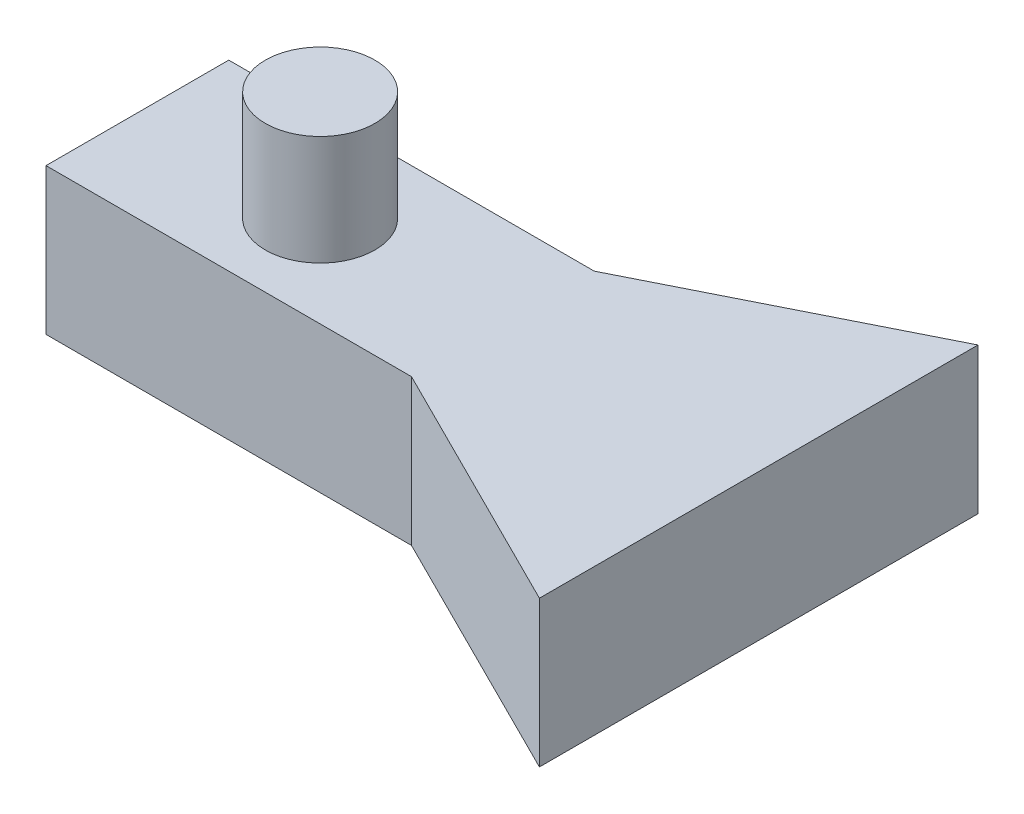
from build123d import *

# Parameters (mm, degrees)
SKETCH1_W           = 1000
SKETCH1_H           = 500
BOSS_EXTRUDE1_DEPTH = 400
SKETCH2_R           = 150
BOSS_EXTRUDE2_DEPTH = 300


with BuildPart() as part:
    # Sketch1 → Boss-Extrude1 (new body)
    with BuildSketch(Plane(origin=(0, 0, 0), x_dir=(1, 0, 0), z_dir=(0, 1, 0))):
        Polygon((1700, -350), (1000, 0), (1000, 500), (1700, 850), align=None)
        with Locations((500, 250)):
            Rectangle(SKETCH1_W, SKETCH1_H)
    extrude(amount=BOSS_EXTRUDE1_DEPTH)

    # Sketch2 → Boss-Extrude2 (add)
    with BuildSketch(Plane(origin=(0, 400, 0), x_dir=(1, 0, 0), z_dir=(0, 1, 0))):
        with Locations(Location((500, 250, 0), (0, 0, 270))):
            Circle(SKETCH2_R)
    extrude(amount=BOSS_EXTRUDE2_DEPTH)


solid = part.part
